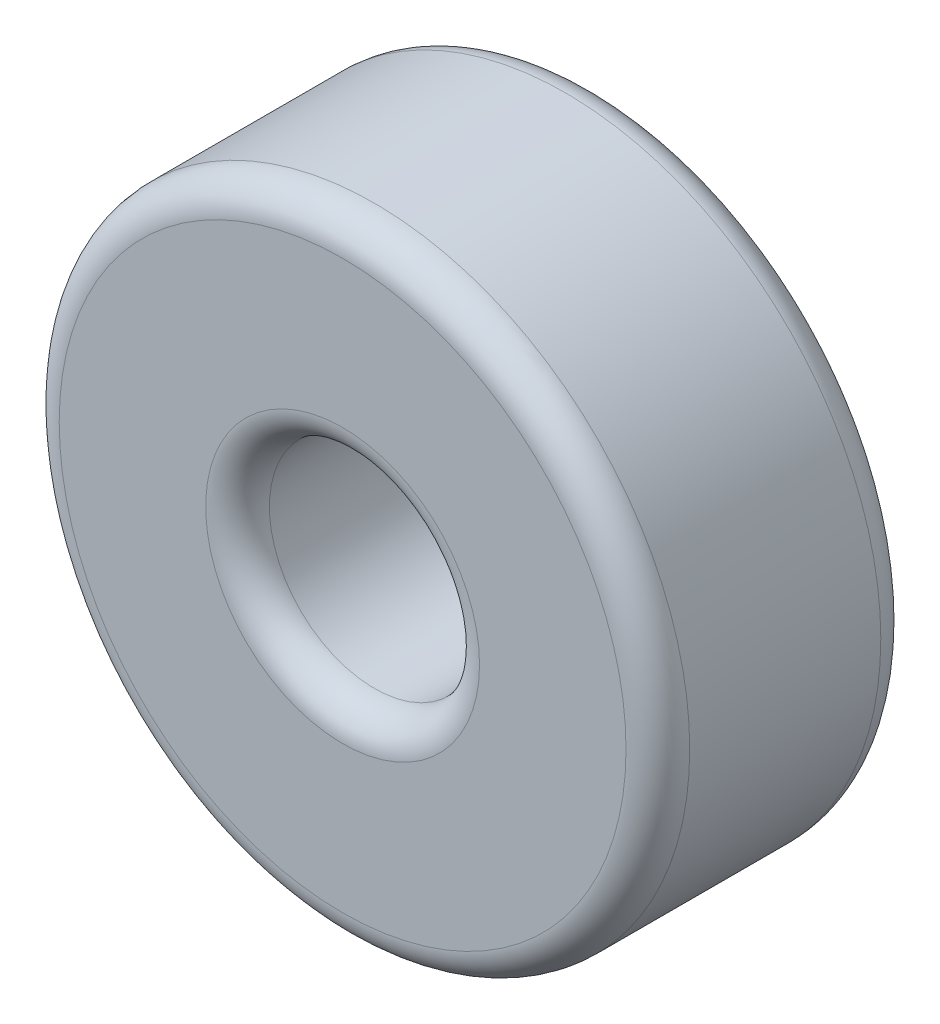
from build123d import *

# Parameters (mm, degrees)
SKETCH_1_R      = 4.95
SKETCH_1_R_2    = 1.65
EXTRUDE_1_DEPTH = 4
FILLET_1_R      = 0.5


with BuildPart() as part:
    # Эскиз1 → Бобышка-Вытянуть1 (new body)
    with BuildSketch(Plane.XY):
        Circle(SKETCH_1_R)
        Circle(SKETCH_1_R_2, mode=Mode.SUBTRACT)
    extrude(amount=EXTRUDE_1_DEPTH)

    # Скругление1
    fillet_1_edges = [part.edges().sort_by_distance(p)[0] for p in [
        (-4.95, 0, 0),
        (-4.95, 0, 4),
        (-1.65, 0, 0),
        (-1.65, 0, 4),
    ]]
    fillet(fillet_1_edges, radius=FILLET_1_R)


solid = part.part
